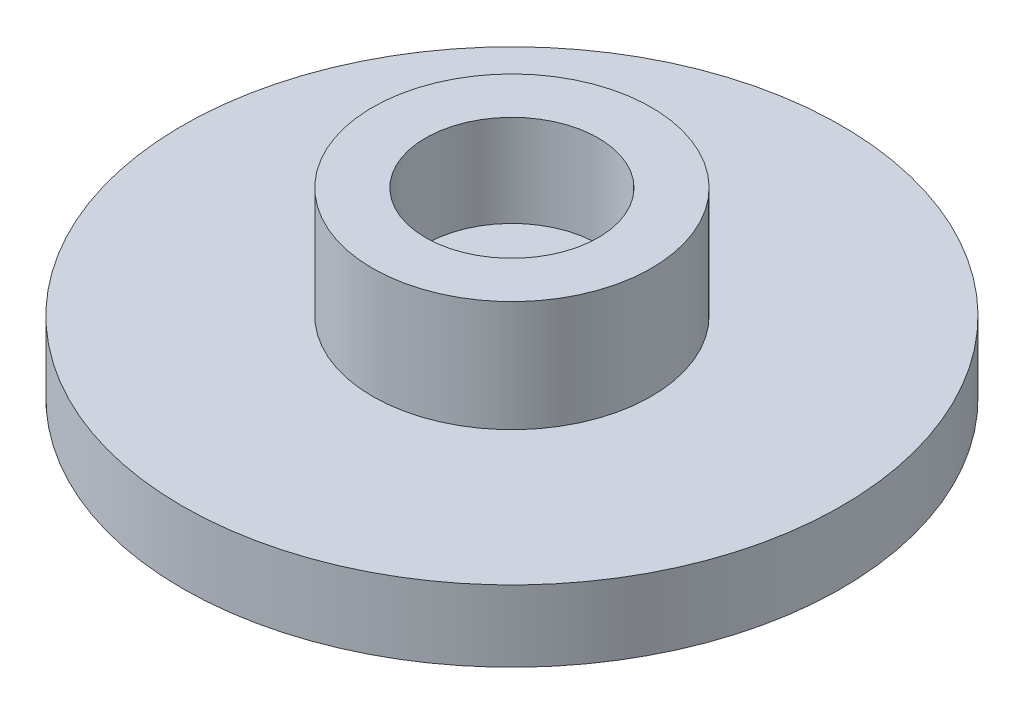
from build123d import *

# Parameters (mm, degrees)
CROQUIS1_R              = 10.4
SALIENTE_EXTRUIR1_DEPTH = 2.25
CROQUIS2_R              = 4.4
SALIENTE_EXTRUIR2_DEPTH = 3.5
CROQUIS3_R              = 2.725
CORTAR_EXTRUIR1_DEPTH   = 2.9


with BuildPart() as part:
    # Croquis1 → Saliente-Extruir1 (new body)
    with BuildSketch(Plane(origin=(0, 0, 0), x_dir=(1, 0, 0), z_dir=(0, 1, 0))):
        with Locations(Location((0, 0, 0), (0, 0, 270))):
            Circle(CROQUIS1_R)
    extrude(amount=SALIENTE_EXTRUIR1_DEPTH)

    # Croquis2 → Saliente-Extruir2 (add)
    with BuildSketch(Plane(origin=(0, 2.25, 0), x_dir=(1, 0, 0), z_dir=(0, 1, 0))):
        with Locations(Location((0, 0, 0), (0, 0, 270))):
            Circle(CROQUIS2_R)
    extrude(amount=SALIENTE_EXTRUIR2_DEPTH)

    # Croquis3 → Cortar-Extruir1 (cut)
    with BuildSketch(Plane(origin=(0, 5.75, 0), x_dir=(1, 0, 0), z_dir=(0, 1, 0))):
        with Locations(Location((0, 0, 0), (0, 0, 270))):
            Circle(CROQUIS3_R)
    extrude(amount=-CORTAR_EXTRUIR1_DEPTH, mode=Mode.SUBTRACT)


solid = part.part
